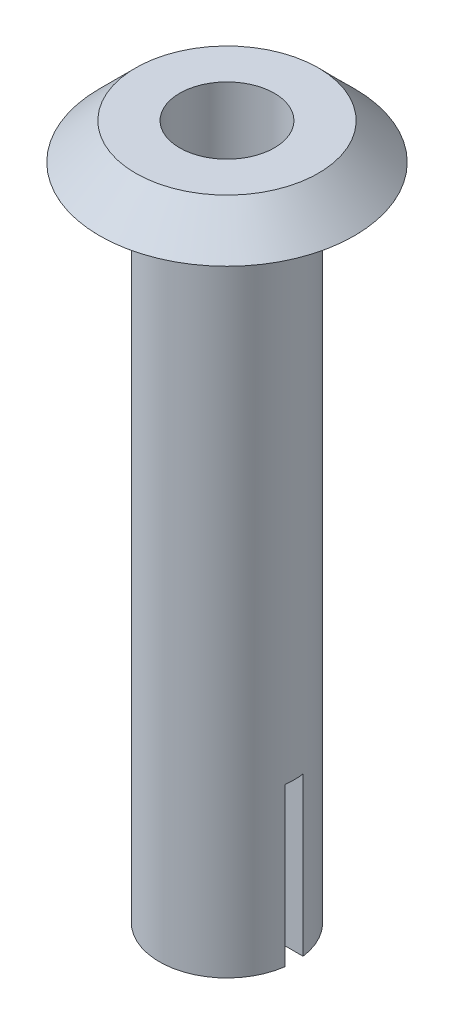
from build123d import *

# Parameters (mm, degrees)
CROQUIS1_R                   = 1.5
SALIENTE_EXTRUIR1_DEPTH      = 15.4
SALIENTE_EXTRUIR2_DEPTH      = 0.0001
SALIENTE_EXTRUIR2_DEPTH_BACK = 0.8
CROQUIS2_R                   = 2.825
CHAFL_N1_SIZE                = 0.8
CROQUIS3_R                   = 1.05
CORTAR_EXTRUIR1_DEPTH        = 13.9
REDONDEO2_R                  = 0.8
CROQUIS6_W                   = 3
CROQUIS6_H                   = 0.4
CORTAR_EXTRUIR4_DEPTH        = 3.5


with BuildPart() as part:
    # Croquis1 → Saliente-Extruir1 (new body)
    with BuildSketch(Plane(origin=(0, 0, 0), x_dir=(1, 0, 0), z_dir=(0, 1, 0))):
        with Locations(Location((0, 0, 0), (0, 0, 90))):
            Circle(CROQUIS1_R)
    extrude(amount=SALIENTE_EXTRUIR1_DEPTH)

    # Croquis2 → Saliente-Extruir2 (add, two sides: drawn at the far end of the back side and taken through both)
    with BuildSketch(Plane(origin=(0, 15.4, 0), x_dir=(1, 0, 0), z_dir=(0, 1, 0)).offset(-SALIENTE_EXTRUIR2_DEPTH_BACK)):
        with Locations(Location((0, 0, 0), (0, 0, 270))):
            Circle(CROQUIS2_R)
    extrude(amount=SALIENTE_EXTRUIR2_DEPTH + SALIENTE_EXTRUIR2_DEPTH_BACK)

    # Chaflán1
    chafl_n1_edges = [part.edges().sort_by_distance(p)[0] for p in [
        (0, 15.4001, -2.825),
    ]]
    chamfer(chafl_n1_edges, length=CHAFL_N1_SIZE)

    # Croquis3 → Cortar-Extruir1 (cut)
    with BuildSketch(Plane(origin=(0, 15.4001, 0), x_dir=(1, 0, 0), z_dir=(0, 1, 0))):
        with Locations(Location((0, 0, 0), (0, 0, 270))):
            Circle(CROQUIS3_R)
    extrude(amount=-CORTAR_EXTRUIR1_DEPTH, mode=Mode.SUBTRACT)

    # Redondeo2
    redondeo2_edges = [part.edges().sort_by_distance(p)[0] for p in [
        (0, 1.5001, -1.05),
    ]]
    fillet(redondeo2_edges, radius=REDONDEO2_R)

    # Croquis6 → Cortar-Extruir4 (cut)
    with BuildSketch(Plane(origin=(0, 0, 0), x_dir=(-1, 0, 0), z_dir=(0, -1, 0))):
        Rectangle(CROQUIS6_W, CROQUIS6_H)
    extrude(amount=-CORTAR_EXTRUIR4_DEPTH, mode=Mode.SUBTRACT)


solid = part.part
